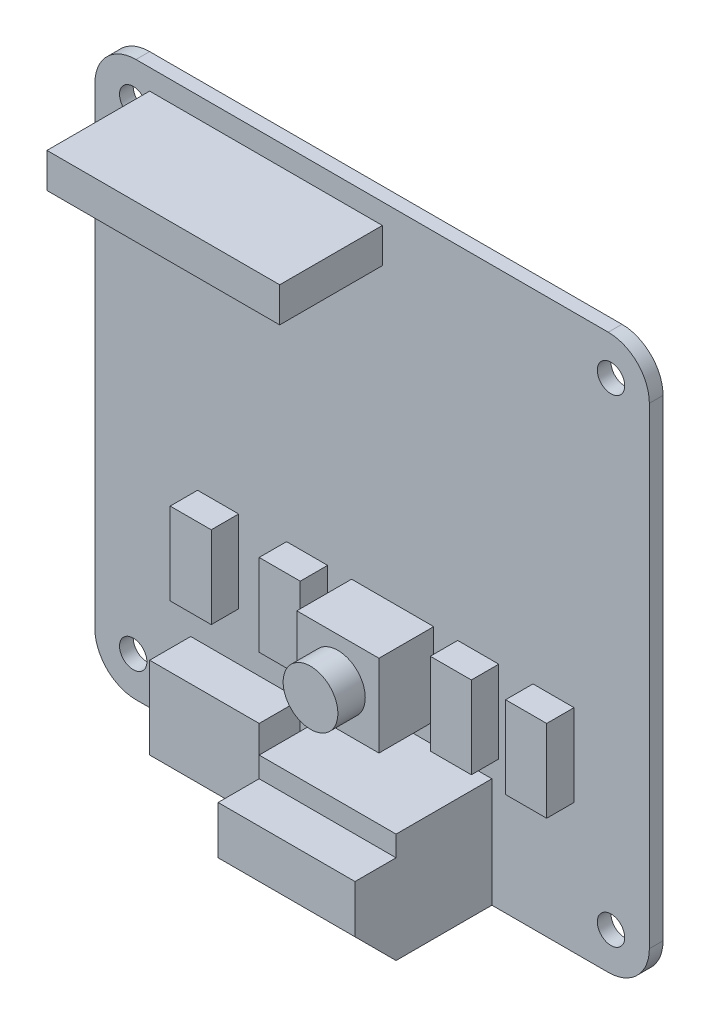
from build123d import *

# Parameters (mm, degrees)
ESQUISSE1_W             = 40.5
ESQUISSE1_H             = 40.5
ESQUISSE1_R             = 1
BOSS_EXTRU_1_DEPTH      = 1
CONG_1_R                = 3
ESQUISSE2_W             = 10
ESQUISSE2_H             = 8
BOSS_EXTRU_2_DEPTH      = 10
ESQUISSE3_W             = 3
ESQUISSE3_H             = 1.5
ENL_V_MAT_EXTRU_1_DEPTH = 10
ESQUISSE4_W             = 8
ESQUISSE4_H             = 6
BOSS_EXTRU_3_DEPTH      = 3
ESQUISSE5_W             = 3
ESQUISSE5_H             = 6
BOSS_EXTRU_4_DEPTH      = 2
ESQUISSE6_W             = 6
ESQUISSE6_H             = 6
BOSS_EXTRU_5_DEPTH      = 4
ESQUISSE7_R             = 2
BOSS_EXTRU_6_DEPTH      = 2
ESQUISSE8_W             = 17
ESQUISSE8_H             = 2.54
BOSS_EXTRU_7_DEPTH      = 7.5


with BuildPart() as part:
    # Esquisse1 → Boss.-Extru.1 (new body)
    with BuildSketch(Plane.XY):
        with Locations((20.25, 20.25)):
            Rectangle(ESQUISSE1_W, ESQUISSE1_H)
        with Locations((37.7, 37.7)):
            Circle(ESQUISSE1_R, mode=Mode.SUBTRACT)
        with Locations((37.7, 2.8)):
            Circle(ESQUISSE1_R, mode=Mode.SUBTRACT)
        with Locations((2.8, 2.8)):
            Circle(ESQUISSE1_R, mode=Mode.SUBTRACT)
        with Locations((2.8, 37.7)):
            Circle(ESQUISSE1_R, mode=Mode.SUBTRACT)
    extrude(amount=BOSS_EXTRU_1_DEPTH)

    # Congé1
    cong_1_edges = [part.edges().sort_by_distance(p)[0] for p in [
        (0, 40.5, 0.5),
        (40.5, 40.5, 0.5),
        (40.5, 0, 0.5),
        (0, 0, 0.5),
    ]]
    fillet(cong_1_edges, radius=CONG_1_R)

    # Esquisse2 → Boss.-Extru.2 (add)
    with BuildSketch(Plane.XY.offset(1)):
        with Locations((24, 4)):
            Rectangle(ESQUISSE2_W, ESQUISSE2_H)
    extrude(amount=BOSS_EXTRU_2_DEPTH)

    # Esquisse3 → Enlèv. mat.-Extru.1 (cut)
    with BuildSketch(Plane(origin=(29, 0, 0), x_dir=(0, 0, -1), z_dir=(1, 0, 0))):
        Polygon((-8, 0), (-11, 3), (-11, 0), align=None)
        with Locations((-9.5, 7.25)):
            Rectangle(ESQUISSE3_W, ESQUISSE3_H)
    extrude(amount=-ENL_V_MAT_EXTRU_1_DEPTH, mode=Mode.SUBTRACT)

    # Esquisse4 → Boss.-Extru.3 (add)
    with BuildSketch(Plane.XY.offset(1)):
        with Locations((11, 3)):
            Rectangle(ESQUISSE4_W, ESQUISSE4_H)
    extrude(amount=BOSS_EXTRU_3_DEPTH)

    # Esquisse5 → Boss.-Extru.4 (add)
    with BuildSketch(Plane.XY.offset(1)):
        with Locations((9, 12.5)):
            Rectangle(ESQUISSE5_W, ESQUISSE5_H)
        with Locations((15.5, 12.5)):
            Rectangle(ESQUISSE5_W, ESQUISSE5_H)
        with Locations((28, 12.5)):
            Rectangle(ESQUISSE5_W, ESQUISSE5_H)
        with Locations((33.5, 12.5)):
            Rectangle(ESQUISSE5_W, ESQUISSE5_H)
    extrude(amount=BOSS_EXTRU_4_DEPTH)

    # Esquisse6 → Boss.-Extru.5 (add)
    with BuildSketch(Plane.XY.offset(1)):
        with Locations((21.75, 12.5)):
            Rectangle(ESQUISSE6_W, ESQUISSE6_H)
    extrude(amount=BOSS_EXTRU_5_DEPTH)

    # Esquisse7 → Boss.-Extru.6 (add)
    with BuildSketch(Plane.XY.offset(5)):
        with Locations((21.75, 12.5)):
            Circle(ESQUISSE7_R)
    extrude(amount=BOSS_EXTRU_6_DEPTH)

    # Esquisse8 → Boss.-Extru.7 (add)
    with BuildSketch(Plane.XY.offset(1)):
        with Locations((12.5, 37.73)):
            Rectangle(ESQUISSE8_W, ESQUISSE8_H)
    extrude(amount=BOSS_EXTRU_7_DEPTH)


solid = part.part
